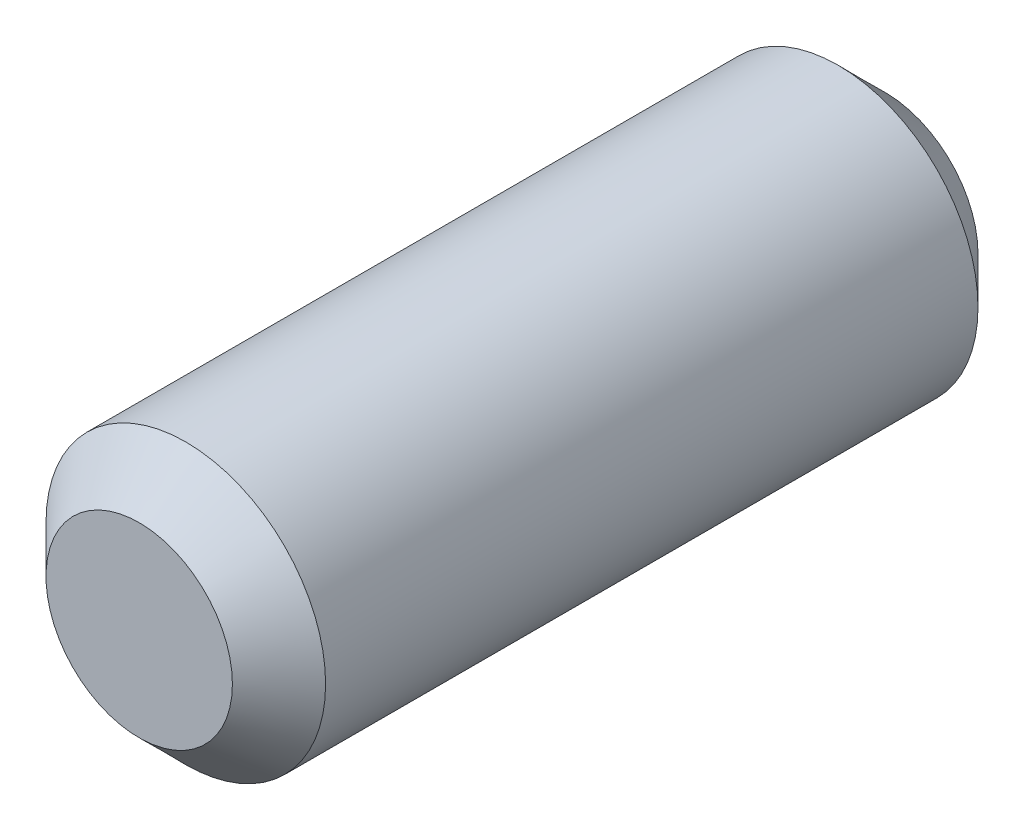
from build123d import *

# Parameters (mm, degrees)
SKETCH_1_R      = 1.5
EXTRUDE_1_DEPTH = 8
CHAMFER_1_SIZE  = 0.5


with BuildPart() as part:
    # 草图1 → 凸台-拉伸1 (new body)
    with BuildSketch(Plane.XY):
        Circle(SKETCH_1_R)
    extrude(amount=EXTRUDE_1_DEPTH)

    # 倒角1
    chamfer_1_edges = [part.edges().sort_by_distance(p)[0] for p in [
        (-1.5, 0, 0),
        (-1.5, 0, 8),
    ]]
    chamfer(chamfer_1_edges, length=CHAMFER_1_SIZE)


solid = part.part
